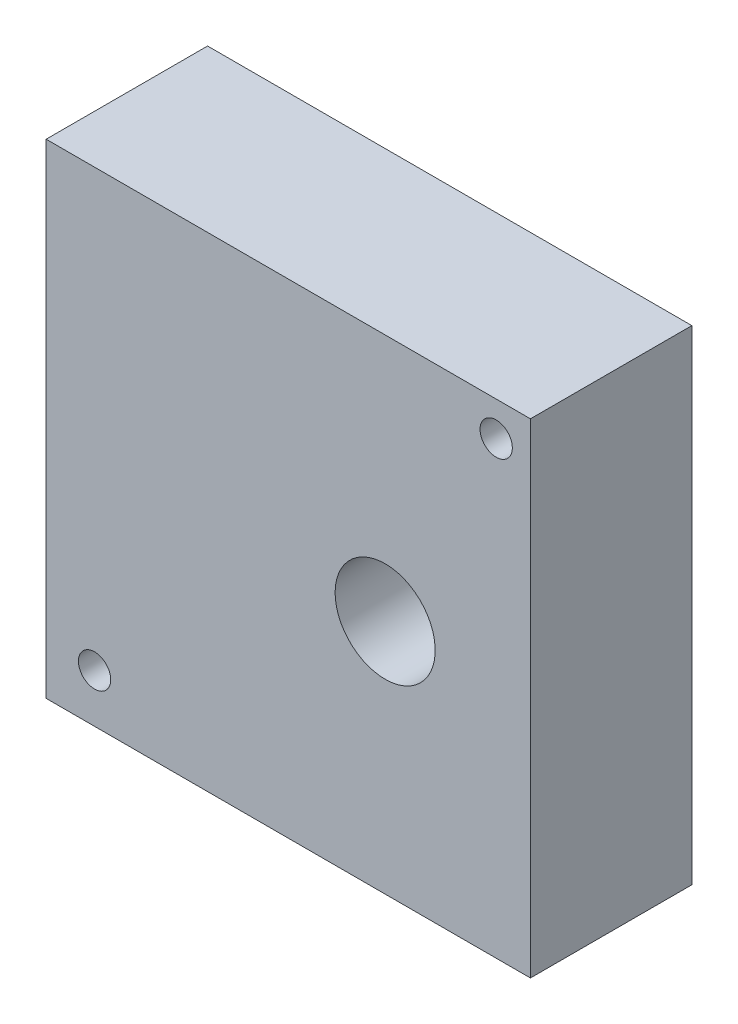
from build123d import *

# Parameters (mm, degrees)
SKETCH1_W             = 30
SKETCH1_H             = 30
BOSS_EXTRUDE1_DEPTH   = 10
SKETCH2_W             = 30
SKETCH2_H             = 30
SKETCH2_W_2           = 20
SKETCH2_H_2           = 20
BOSS_EXTRUDE2_DEPTH   = 10
SKETCH2_W_3           = 5
SKETCH2_H_3           = 3.748828889
BOSS_EXTRUDE2_2_DEPTH = 10
BOSS_EXTRUDE2_3_DEPTH = 10
SKETCH3_W             = 30
SKETCH3_H             = 30
BOSS_EXTRUDE3_DEPTH   = 10
SKETCH4_R             = 3.1
CUT_EXTRUDE1_DEPTH    = 10
SKETCH5_R             = 3.1
CUT_EXTRUDE2_DEPTH    = 10
CUT_EXTRUDE3_START    = -30
SKETCH8_R             = 1
CUT_EXTRUDE3_DEPTH    = 30


with BuildPart() as part:
    # Sketch1 → Boss-Extrude1 (new body)
    with BuildSketch(Plane.XY):
        Rectangle(SKETCH1_W, SKETCH1_H)
    extrude(amount=BOSS_EXTRUDE1_DEPTH)

    # Sketch5 → Cut-Extrude2 (cut)
    with BuildSketch(Plane(origin=(0, 0, 0), x_dir=(-1, 0, 0), z_dir=(0, 0, -1))):
        with Locations((-6, -0.372899474)):
            Circle(SKETCH5_R)
    extrude(amount=-CUT_EXTRUDE2_DEPTH, mode=Mode.SUBTRACT)


with BuildPart() as body_2:
    # Sketch2 → Boss-Extrude2 (new body)
    with BuildSketch(Plane.XY.offset(10)):
        Rectangle(SKETCH2_W, SKETCH2_H)
        Rectangle(SKETCH2_W_2, SKETCH2_H_2, mode=Mode.SUBTRACT)
    extrude(amount=BOSS_EXTRUDE2_DEPTH)


with BuildPart() as body_3:
    # Sketch2 → Boss-Extrude2 2 (new body)
    with BuildSketch(Plane.XY.offset(10)):
        with Locations((0, 5.374414445)):
            Rectangle(SKETCH2_W_3, SKETCH2_H_3)
    extrude(amount=BOSS_EXTRUDE2_2_DEPTH)


with BuildPart() as body_4:
    # Sketch2 → Boss-Extrude2 3 (new body)
    with BuildSketch(Plane.XY.offset(10)):
        with Locations((0, -5.374414445)):
            Rectangle(SKETCH2_W_3, SKETCH2_H_3)
    extrude(amount=BOSS_EXTRUDE2_3_DEPTH)


with BuildPart() as body_5:
    # Sketch3 → Boss-Extrude3 (new body)
    with BuildSketch(Plane.XY.offset(20)):
        Rectangle(SKETCH3_W, SKETCH3_H)
    extrude(amount=BOSS_EXTRUDE3_DEPTH)

    # Sketch4 → Cut-Extrude1 (cut)
    with BuildSketch(Plane.XY.offset(30)):
        with Locations((-6, 0)):
            Circle(SKETCH4_R)
    extrude(amount=-CUT_EXTRUDE1_DEPTH, mode=Mode.SUBTRACT)


with BuildPart() as cut_extrude3_tool:
    # Sketch8 → Cut-Extrude3 (new body)
    with BuildSketch(Plane.XY.offset(30).offset(CUT_EXTRUDE3_START)):
        with Locations((-12, -12)):
            Circle(SKETCH8_R)
        with Locations((12.878679656, 12.878679656)):
            Circle(SKETCH8_R)
    extrude(amount=CUT_EXTRUDE3_DEPTH)


with BuildPart() as part_1:
    add(part.part)

    # Cut-Extrude3: cut by cut_extrude3_tool
    add(cut_extrude3_tool.part, mode=Mode.SUBTRACT)


with BuildPart() as body_2_1:
    add(body_2.part)

    # Cut-Extrude3: cut by cut_extrude3_tool
    add(cut_extrude3_tool.part, mode=Mode.SUBTRACT)


with BuildPart() as body_5_1:
    add(body_5.part)

    # Cut-Extrude3: cut by cut_extrude3_tool
    add(cut_extrude3_tool.part, mode=Mode.SUBTRACT)


solid = part_1.part
